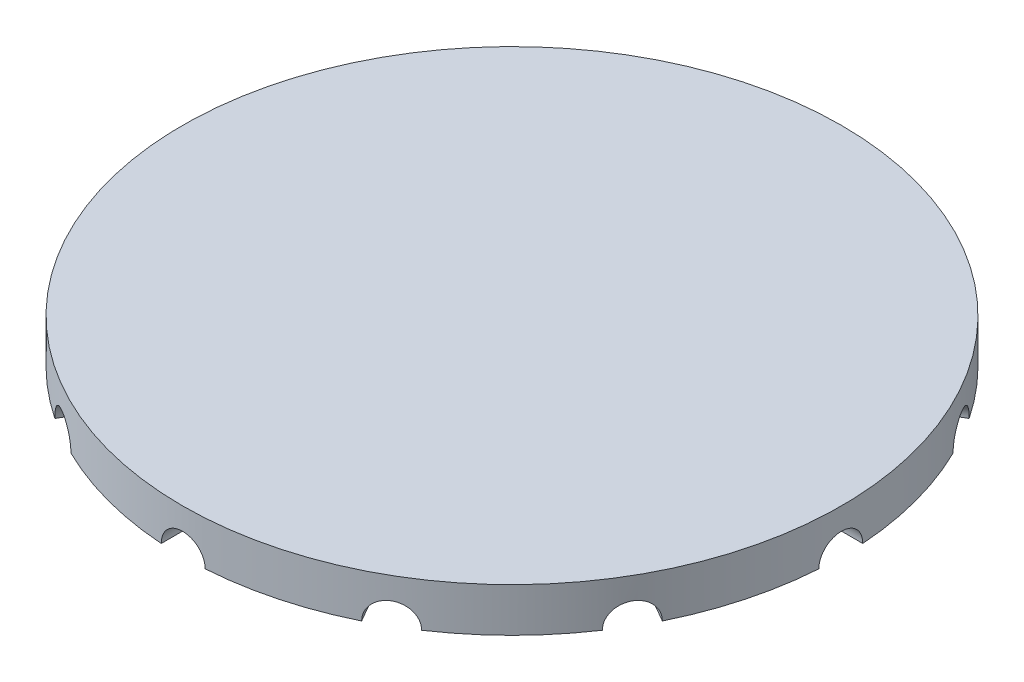
from build123d import *

# Parameters (mm, degrees)
SKETCH_1_W               = 2.5
SKETCH_1_H               = 60
EXTRUDE_1_DEPTH          = 5
EXTRUDE_2_DEPTH          = 5
CUT_EXTRUDE_START        = -60
SKETCH_4_R               = 2.5
CUT_EXTRUDE_1_DEPTH      = 60
PATTERN_CIRCULAR_2_COUNT = 12
SKETCH_5_R               = 20
CUT_EXTRUDE_2_DEPTH      = 2.5


with BuildPart() as part:
    # Эскиз1 → Повернуть2 (revolve)
    with BuildSketch(Plane(origin=(0, 0, 0), x_dir=(1, 0, 0), z_dir=(0, 1, 0)), mode=Mode.PRIVATE) as revolve_2_sk:
        with Locations((-1.25, 30)):
            Rectangle(SKETCH_1_W, SKETCH_1_H)
    revolve(revolve_2_sk.sketch.rotate(Axis((0, 0, 37.5), (0, 0, -1)), 180), axis=Axis((0, 0, 37.5), (0, 0, -1)))

    # Эскиз1<5> → Бобышка-Вытянуть1 (add)
    with BuildSketch(Plane(origin=(0, 0, 0), x_dir=(1, 0, 0), z_dir=(0, 1, 0))):
        with BuildLine():
            ThreePointArc((20, 0), (-13.228756555, -15), (-2.5, 19.843134833))
            Line((-2.5, 19.843134833), (-2.5, 37.416573868))
            ThreePointArc((-2.5, 37.416573868), (-25.617376915, -27.386127875), (37.5, 0))
            ThreePointArc((37.5, 0), (26.516504294, 26.516504294), (0, 37.5))
            Line((0, 37.5), (0, 20))
            ThreePointArc((0, 20), (14.142135624, 14.142135624), (20, 0))
        make_face()
        with BuildLine():
            Line((-2.5, 37.416573868), (-2.5, 19.843134833))
            ThreePointArc((-2.5, 19.843134833), (-1.252458251, 19.960745185), (0, 20))
            Line((0, 20), (0, 37.5))
            ThreePointArc((0, 37.5), (-1.250695798, 37.479137664), (-2.5, 37.416573868))
        make_face()
    extrude(amount=EXTRUDE_1_DEPTH)

    # Эскиз1<6> → Бобышка-Вытянуть2 (add)
    with BuildSketch(Plane(origin=(0, 0, 0), x_dir=(1, 0, 0), z_dir=(0, 1, 0))):
        with BuildLine():
            Line((0, 0), (-2.5, 0))
            Line((-2.5, 0), (-2.5, 19.843134833))
            ThreePointArc((-2.5, 19.843134833), (-13.228756555, -15), (20, 0))
            ThreePointArc((20, 0), (14.142135624, 14.142135624), (0, 20))
            Line((0, 20), (0, 0))
        make_face()
        with BuildLine():
            Line((-2.5, 19.843134833), (-2.5, 0))
            Line((-2.5, 0), (0, 0))
            Line((0, 0), (0, 20))
            ThreePointArc((0, 20), (-1.252458251, 19.960745185), (-2.5, 19.843134833))
        make_face()
    extrude(amount=EXTRUDE_2_DEPTH)

    # Эскиз4 → Вырез-Вытянуть1 (cut)
    with BuildSketch(Plane(origin=(0, 0, -60), x_dir=(-1, 0, 0), z_dir=(0, 0, -1)).offset(CUT_EXTRUDE_START)):
        Circle(SKETCH_4_R)
    cut_extrude_1 = extrude(amount=CUT_EXTRUDE_1_DEPTH, mode=Mode.SUBTRACT)

    # Круговой массив2: Вырез-Вытянуть1 ×12 about axis
    pattern_circular_2_axis = Axis((0, 29.957095594, 0), (0, -1, 0))
    for i in range(1, PATTERN_CIRCULAR_2_COUNT):
        add(cut_extrude_1.rotate(pattern_circular_2_axis, i * 360 / PATTERN_CIRCULAR_2_COUNT), mode=Mode.SUBTRACT)

    # Эскиз5 → Вырез-Вытянуть2 (cut)
    with BuildSketch(Plane.XZ):
        Circle(SKETCH_5_R)
    extrude(amount=-CUT_EXTRUDE_2_DEPTH, mode=Mode.SUBTRACT)


solid = part.part
